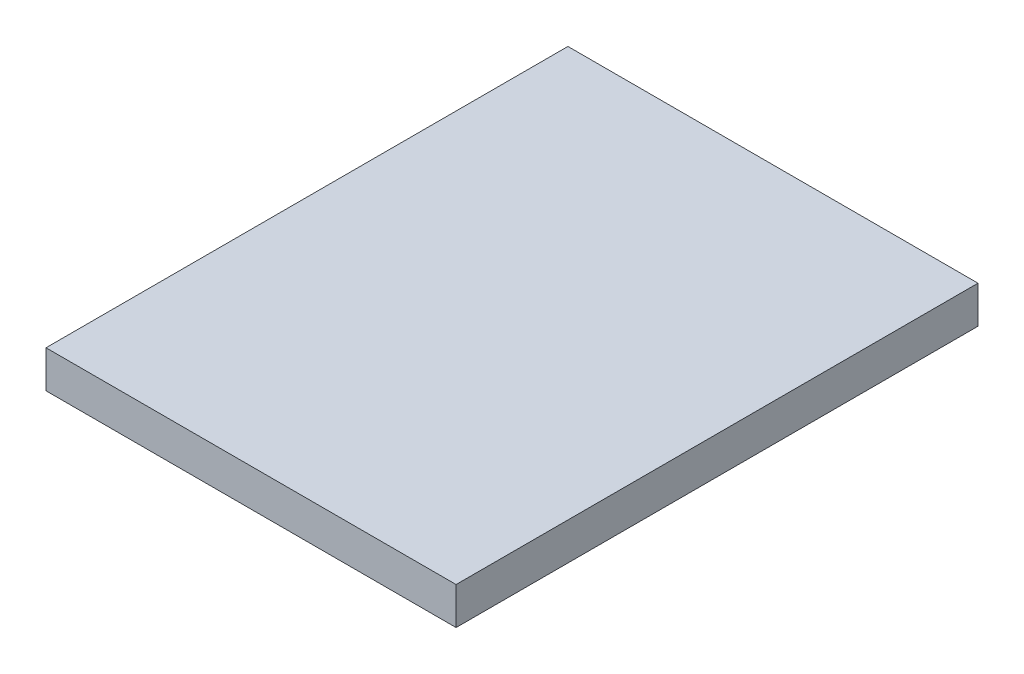
from build123d import *

# Parameters (mm, degrees)
SKETCH1_W           = 110
SKETCH1_H           = 140
BOSS_EXTRUDE1_DEPTH = 10


with BuildPart() as part:
    # Sketch1 → Boss-Extrude1 (new body)
    with BuildSketch(Plane(origin=(0, 0, 0), x_dir=(1, 0, 0), z_dir=(0, 1, 0))):
        Rectangle(SKETCH1_W, SKETCH1_H)
    extrude(amount=BOSS_EXTRUDE1_DEPTH)


solid = part.part
